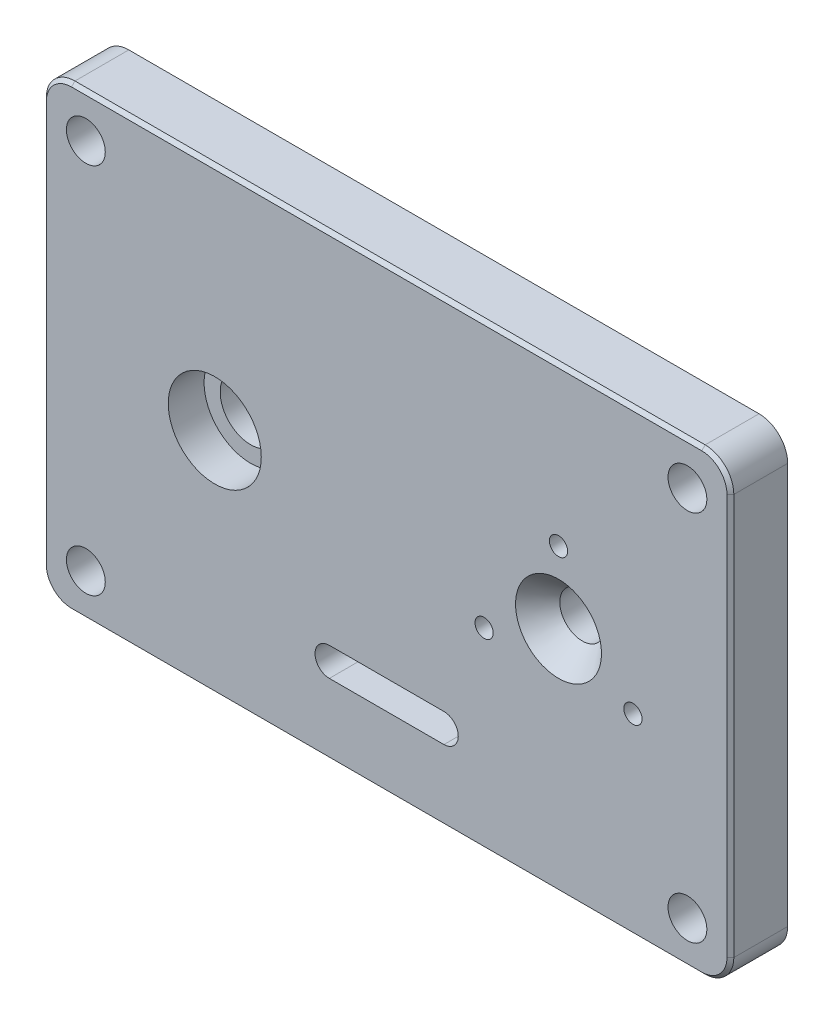
from build123d import *

# Parameters (mm, degrees)
EXTRUDE_1_DEPTH     = 12.7
SKETCH_2_R          = 4.3053
CUT_EXTRUDE_1_DEPTH = 184.601770144
CUT_EXTRUDE_2_DEPTH = 184.601770144
SKETCH_4_R          = 10.3124
CUT_EXTRUDE_3_DEPTH = 7.9502
SKETCH_5_R          = 6.7437
CUT_EXTRUDE_4_DEPTH = 184.601770144
SKETCH_6_R          = 9.525
CUT_EXTRUDE_5_DEPTH = 5.244874679
CUT_EXTRUDE_5_DRAFT = -41
SKETCH_7_R          = 4.9657
CUT_EXTRUDE_6_DEPTH = 184.601770144
SKETCH_8_R          = 2.0193
CUT_EXTRUDE_7_DEPTH = 9.525
CHAMFER_1_SIZE      = 0.762


with BuildPart() as part:
    # 草图1 → 凸台-拉伸1 (new body)
    with BuildSketch(Plane.XY):
        with BuildLine():
            Line((6.35, 0), (146.05, 0))
            ThreePointArc((146.05, 0), (150.540128061, 1.859871939), (152.4, 6.35))
            Line((152.4, 6.35), (152.4, 95.25))
            ThreePointArc((152.4, 95.25), (150.540128061, 99.740128061), (146.05, 101.6))
            Line((146.05, 101.6), (6.35, 101.6))
            ThreePointArc((6.35, 101.6), (1.859871939, 99.740128061), (0, 95.25))
            Line((0, 95.25), (0, 6.35))
            ThreePointArc((0, 6.35), (1.859871939, 1.859871939), (6.35, 0))
        make_face()
    extrude(amount=EXTRUDE_1_DEPTH)

    # 草图2 → 切除-拉伸1 (cut, through all)
    with BuildSketch(Plane.XY.offset(12.7)):
        with Locations((9.525, 9.525)):
            Circle(SKETCH_2_R)
        with Locations((142.875, 9.525)):
            Circle(SKETCH_2_R)
        with Locations((9.525, 92.075)):
            Circle(SKETCH_2_R)
        with Locations((142.875, 92.075)):
            Circle(SKETCH_2_R)
    extrude(amount=-CUT_EXTRUDE_1_DEPTH, mode=Mode.SUBTRACT)

    # 草图3 → 切除-拉伸2 (cut, through all)
    with BuildSketch(Plane.XY.offset(12.7)):
        with BuildLine():
            Line((63.5, 15.875), (88.9, 15.875))
            ThreePointArc((88.9, 15.875), (92.075, 19.05), (88.9, 22.225))
            Line((88.9, 22.225), (63.5, 22.225))
            ThreePointArc((63.5, 22.225), (60.325, 19.05), (63.5, 15.875))
        make_face()
    extrude(amount=-CUT_EXTRUDE_2_DEPTH, mode=Mode.SUBTRACT)

    # 草图4 → 切除-拉伸3 (cut)
    with BuildSketch(Plane.XY.offset(12.7)):
        with Locations((38.1, 50.8)):
            Circle(SKETCH_4_R)
    extrude(amount=-CUT_EXTRUDE_3_DEPTH, mode=Mode.SUBTRACT)

    # 草图5 → 切除-拉伸4 (cut, through all)
    with BuildSketch(Plane.XY.offset(12.7)):
        with Locations((38.1, 50.8)):
            Circle(SKETCH_5_R)
    extrude(amount=-CUT_EXTRUDE_4_DEPTH, mode=Mode.SUBTRACT)


with BuildPart() as cut_extrude_5_tool:
    # 草图6 → 切除-拉伸5 (with draft: the straight prism first)
    with BuildSketch(Plane.XY.offset(12.7)):
        with Locations((114.3, 50.8)):
            Circle(SKETCH_6_R)
    extrude(amount=-CUT_EXTRUDE_5_DEPTH)
    # 切除-拉伸5: the draft: its side faces are tilted about the plane it starts from
    cut_extrude_5_sides = [cut_extrude_5_tool.faces().sort_by_distance(p)[0] for p in [
        (104.775, 50.8, 10.07756266),
    ]]
    draft(cut_extrude_5_sides, Plane.XY.offset(12.7), CUT_EXTRUDE_5_DRAFT)


with BuildPart() as part_1:
    add(part.part)

    # 切除-拉伸5: cut by cut_extrude_5_tool
    add(cut_extrude_5_tool.part, mode=Mode.SUBTRACT)

    # 草图7 → 切除-拉伸6 (cut, through all)
    with BuildSketch(Plane.XY.offset(12.7)):
        with Locations((114.3, 50.8)):
            Circle(SKETCH_7_R)
    extrude(amount=-CUT_EXTRUDE_6_DEPTH, mode=Mode.SUBTRACT)

    # 草图8 → 切除-拉伸7 (cut)
    with BuildSketch(Plane.XY.offset(12.7)):
        with Locations((114.3, 66.675)):
            Circle(SKETCH_8_R)
        with Locations((97.802, 42.725)):
            Circle(SKETCH_8_R)
        with Locations((130.798, 42.725)):
            Circle(SKETCH_8_R)
    extrude(amount=-CUT_EXTRUDE_7_DEPTH, mode=Mode.SUBTRACT)

    # 倒角1
    chamfer_1_edges = [part_1.edges().sort_by_distance(p)[0] for p in [
        (150.540128061, 1.859871939, 12.7),
        (152.4, 50.8, 12.7),
        (150.540128061, 99.740128061, 12.7),
        (76.2, 101.6, 12.7),
        (1.859871939, 99.740128061, 12.7),
        (0, 50.8, 12.7),
        (1.859871939, 1.859871939, 12.7),
        (76.2, 0, 12.7),
    ]]
    chamfer(chamfer_1_edges, length=CHAMFER_1_SIZE)


solid = part_1.part
